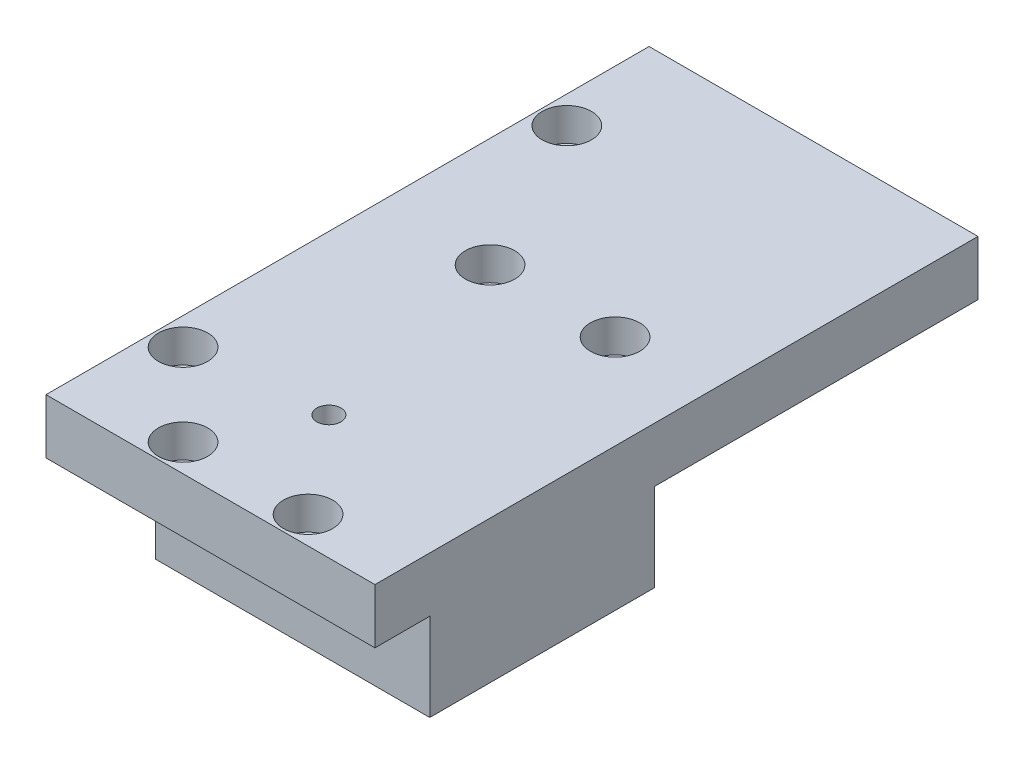
from build123d import *

# Parameters (mm, degrees)
SKETCH_1_W          = 30
SKETCH_1_H          = 55
EXTRUDE_1_DEPTH     = 5
SKETCH_4_R          = 1.5
CUT_EXTRUDE_1_DEPTH = 63.84902545
SKETCH_4_3_R        = 2.25
CUT_EXTRUDE_2_DEPTH = 3
SKETCH_5_W          = 25
SKETCH_5_H          = 20.5
EXTRUDE_2_DEPTH     = 8
SKETCH_6_R          = 3.1
CUT_EXTRUDE_3_DEPTH = 2.6
SKETCH_6_3_R        = 1.1
CUT_EXTRUDE_4_DEPTH = 64.984373092


with BuildPart() as part:
    # 草图1 → 凸台-拉伸1 (new body)
    with BuildSketch(Plane(origin=(0, 0, 0), x_dir=(1, 0, 0), z_dir=(0, 1, 0))):
        with Locations((-15, -27.5)):
            Rectangle(SKETCH_1_W, SKETCH_1_H)
    extrude(amount=EXTRUDE_1_DEPTH)

    # 草图4 → 切除-拉伸1 (cut, through all)
    with BuildSketch(Plane(origin=(0, 5, 0), x_dir=(1, 0, 0), z_dir=(0, 1, 0))):
        with Locations(Location((-27.5, -10, 0), (0, 0, 270))):
            Circle(SKETCH_4_R)
        with Locations(Location((-27.5, -45, 0), (0, 0, 270))):
            Circle(SKETCH_4_R)
        with Locations(Location((-20, -52.5, 0), (0, 0, 270))):
            Circle(SKETCH_4_R)
        with Locations(Location((-8.6, -52.5, 0), (0, 0, 270))):
            Circle(SKETCH_4_R)
        with Locations(Location((-8.6, -24.5, 0), (0, 0, 270))):
            Circle(SKETCH_4_R)
        with Locations(Location((-20, -24.5, 0), (0, 0, 270))):
            Circle(SKETCH_4_R)
    extrude(amount=-CUT_EXTRUDE_1_DEPTH, mode=Mode.SUBTRACT)

    # 草图4<3> → 切除-拉伸2 (cut)
    with BuildSketch(Plane(origin=(0, 5, 0), x_dir=(1, 0, 0), z_dir=(0, 1, 0))):
        with Locations(Location((-27.5, -10, 0), (0, 0, 270))):
            Circle(SKETCH_4_3_R)
        with Locations(Location((-27.5, -45, 0), (0, 0, 270))):
            Circle(SKETCH_4_3_R)
        with Locations(Location((-20, -52.5, 0), (0, 0, 270))):
            Circle(SKETCH_4_3_R)
        with Locations(Location((-8.6, -52.5, 0), (0, 0, 270))):
            Circle(SKETCH_4_3_R)
        with Locations(Location((-8.6, -24.5, 0), (0, 0, 270))):
            Circle(SKETCH_4_3_R)
        with Locations(Location((-20, -24.5, 0), (0, 0, 270))):
            Circle(SKETCH_4_3_R)
    extrude(amount=-CUT_EXTRUDE_2_DEPTH, mode=Mode.SUBTRACT)

    # 草图5 → 凸台-拉伸2 (add)
    with BuildSketch(Plane.XZ):
        with Locations((-12.5, 39.75)):
            Rectangle(SKETCH_5_W, SKETCH_5_H)
    extrude(amount=EXTRUDE_2_DEPTH)

    # 草图6 → 切除-拉伸3 (cut)
    with BuildSketch(Plane.XZ.offset(8)):
        with Locations(Location((-4.6, 40.035904331, 0), (0, 0, 270))):
            Circle(SKETCH_6_R)
    extrude(amount=-CUT_EXTRUDE_3_DEPTH, mode=Mode.SUBTRACT)

    # 草图6<3> → 切除-拉伸4 (cut, through all)
    with BuildSketch(Plane.XZ.offset(8)):
        with Locations(Location((-15.5, 43.701964887, 0), (0, 0, 270))):
            Circle(SKETCH_6_3_R)
    extrude(amount=-CUT_EXTRUDE_4_DEPTH, mode=Mode.SUBTRACT)


solid = part.part
